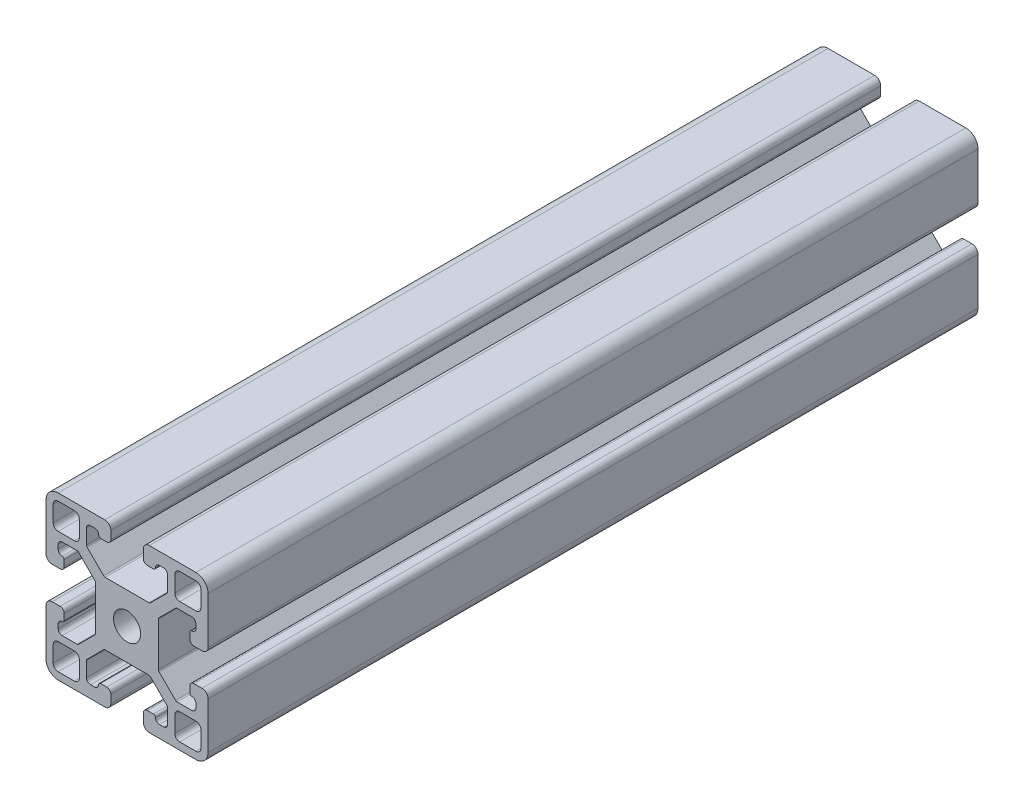
from build123d import *

# Parameters (mm, degrees)
SKETCH1_R           = 3.35
BOSS_EXTRUDE1_DEPTH = 190


with BuildPart() as part:
    # Sketch1 → Boss-Extrude1 (new body)
    with BuildSketch(Plane.XY):
        with BuildLine():
            Line((-9.853553391, -11.978553391), (-5.771446609, -7.896446609))
            ThreePointArc((-5.771446609, -7.896446609), (-5.609234935, -7.788060234), (-5.417893219, -7.75))
            Line((-5.417893219, -7.75), (5.417893219, -7.75))
            ThreePointArc((5.417893219, -7.75), (5.609234935, -7.788060234), (5.771446609, -7.896446609))
            Line((5.771446609, -7.896446609), (9.853553391, -11.978553391))
            ThreePointArc((9.853553391, -11.978553391), (9.961939766, -12.140765065), (10, -12.332106781))
            Line((10, -12.332106781), (10, -16))
            ThreePointArc((10, -16), (9.707106781, -16.707106781), (9, -17))
            Line((9, -17), (8, -17))
            ThreePointArc((8, -17), (7.292893219, -16.707106781), (7, -16))
            ThreePointArc((7, -16), (6.853553391, -15.646446609), (6.5, -15.5))
            Line((6.5, -15.5), (5, -15.5))
            ThreePointArc((5, -15.5), (4.292893219, -15.792893219), (4, -16.5))
            Line((4, -16.5), (4, -18.5))
            ThreePointArc((4, -18.5), (4.439339828, -19.560660172), (5.5, -20))
            Line((5.5, -20), (17, -20))
            ThreePointArc((17, -20), (19.121320344, -19.121320344), (20, -17))
            Line((20, -17), (20, -5.5))
            ThreePointArc((20, -5.5), (19.560660172, -4.439339828), (18.5, -4))
            Line((18.5, -4), (16.5, -4))
            ThreePointArc((16.5, -4), (15.792893219, -4.292893219), (15.5, -5))
            Line((15.5, -5), (15.5, -6.5))
            ThreePointArc((15.5, -6.5), (15.646446609, -6.853553391), (16, -7))
            ThreePointArc((16, -7), (16.707106781, -7.292893219), (17, -8))
            Line((17, -8), (17, -9))
            ThreePointArc((17, -9), (16.707106781, -9.707106781), (16, -10))
            Line((16, -10), (12.332106781, -10))
            ThreePointArc((12.332106781, -10), (12.140765065, -9.961939766), (11.978553391, -9.853553391))
            Line((11.978553391, -9.853553391), (7.896446609, -5.771446609))
            ThreePointArc((7.896446609, -5.771446609), (7.788060234, -5.609234935), (7.75, -5.417893219))
            Line((7.75, -5.417893219), (7.75, 5.417893219))
            ThreePointArc((7.75, 5.417893219), (7.788060234, 5.609234935), (7.896446609, 5.771446609))
            Line((7.896446609, 5.771446609), (11.978553391, 9.853553391))
            ThreePointArc((11.978553391, 9.853553391), (12.140765065, 9.961939766), (12.332106781, 10))
            Line((12.332106781, 10), (16, 10))
            ThreePointArc((16, 10), (16.707106781, 9.707106781), (17, 9))
            Line((17, 9), (17, 8))
            ThreePointArc((17, 8), (16.707106781, 7.292893219), (16, 7))
            ThreePointArc((16, 7), (15.646446609, 6.853553391), (15.5, 6.5))
            Line((15.5, 6.5), (15.5, 5))
            ThreePointArc((15.5, 5), (15.792893219, 4.292893219), (16.5, 4))
            Line((16.5, 4), (18.5, 4))
            ThreePointArc((18.5, 4), (19.560660172, 4.439339828), (20, 5.5))
            Line((20, 5.5), (20, 17))
            ThreePointArc((20, 17), (19.121320344, 19.121320344), (17, 20))
            Line((17, 20), (5.5, 20))
            ThreePointArc((5.5, 20), (4.439339828, 19.560660172), (4, 18.5))
            Line((4, 18.5), (4, 16.5))
            ThreePointArc((4, 16.5), (4.292893219, 15.792893219), (5, 15.5))
            Line((5, 15.5), (6.5, 15.5))
            ThreePointArc((6.5, 15.5), (6.853553391, 15.646446609), (7, 16))
            ThreePointArc((7, 16), (7.292893219, 16.707106781), (8, 17))
            Line((8, 17), (9, 17))
            ThreePointArc((9, 17), (9.707106781, 16.707106781), (10, 16))
            Line((10, 16), (10, 12.332106781))
            ThreePointArc((10, 12.332106781), (9.961939766, 12.140765065), (9.853553391, 11.978553391))
            Line((9.853553391, 11.978553391), (5.771446609, 7.896446609))
            ThreePointArc((5.771446609, 7.896446609), (5.609234935, 7.788060234), (5.417893219, 7.75))
            Line((5.417893219, 7.75), (-5.417893219, 7.75))
            ThreePointArc((-5.417893219, 7.75), (-5.609234935, 7.788060234), (-5.771446609, 7.896446609))
            Line((-5.771446609, 7.896446609), (-9.853553391, 11.978553391))
            ThreePointArc((-9.853553391, 11.978553391), (-9.961939766, 12.140765065), (-10, 12.332106781))
            Line((-10, 12.332106781), (-10, 16))
            ThreePointArc((-10, 16), (-9.707106781, 16.707106781), (-9, 17))
            Line((-9, 17), (-8, 17))
            ThreePointArc((-8, 17), (-7.292893219, 16.707106781), (-7, 16))
            ThreePointArc((-7, 16), (-6.853553391, 15.646446609), (-6.5, 15.5))
            Line((-6.5, 15.5), (-5, 15.5))
            ThreePointArc((-5, 15.5), (-4.292893219, 15.792893219), (-4, 16.5))
            Line((-4, 16.5), (-4, 18.5))
            ThreePointArc((-4, 18.5), (-4.439339828, 19.560660172), (-5.5, 20))
            Line((-5.5, 20), (-17, 20))
            ThreePointArc((-17, 20), (-19.121320344, 19.121320344), (-20, 17))
            Line((-20, 17), (-20, 5.5))
            ThreePointArc((-20, 5.5), (-19.560660172, 4.439339828), (-18.5, 4))
            Line((-18.5, 4), (-16.5, 4))
            ThreePointArc((-16.5, 4), (-15.792893219, 4.292893219), (-15.5, 5))
            Line((-15.5, 5), (-15.5, 6.5))
            ThreePointArc((-15.5, 6.5), (-15.646446609, 6.853553391), (-16, 7))
            ThreePointArc((-16, 7), (-16.707106781, 7.292893219), (-17, 8))
            Line((-17, 8), (-17, 9))
            ThreePointArc((-17, 9), (-16.707106781, 9.707106781), (-16, 10))
            Line((-16, 10), (-12.332106781, 10))
            ThreePointArc((-12.332106781, 10), (-12.140765065, 9.961939766), (-11.978553391, 9.853553391))
            Line((-11.978553391, 9.853553391), (-7.896446609, 5.771446609))
            ThreePointArc((-7.896446609, 5.771446609), (-7.788060234, 5.609234935), (-7.75, 5.417893219))
            Line((-7.75, 5.417893219), (-7.75, -5.417893219))
            ThreePointArc((-7.75, -5.417893219), (-7.788060234, -5.609234935), (-7.896446609, -5.771446609))
            Line((-7.896446609, -5.771446609), (-11.978553391, -9.853553391))
            ThreePointArc((-11.978553391, -9.853553391), (-12.140765065, -9.961939766), (-12.332106781, -10))
            Line((-12.332106781, -10), (-16, -10))
            ThreePointArc((-16, -10), (-16.707106781, -9.707106781), (-17, -9))
            Line((-17, -9), (-17, -8))
            ThreePointArc((-17, -8), (-16.707106781, -7.292893219), (-16, -7))
            ThreePointArc((-16, -7), (-15.646446609, -6.853553391), (-15.5, -6.5))
            Line((-15.5, -6.5), (-15.5, -5))
            ThreePointArc((-15.5, -5), (-15.792893219, -4.292893219), (-16.5, -4))
            Line((-16.5, -4), (-18.5, -4))
            ThreePointArc((-18.5, -4), (-19.560660172, -4.439339828), (-20, -5.5))
            Line((-20, -5.5), (-20, -17))
            ThreePointArc((-20, -17), (-19.121320344, -19.121320344), (-17, -20))
            Line((-17, -20), (-5.5, -20))
            ThreePointArc((-5.5, -20), (-4.439339828, -19.560660172), (-4, -18.5))
            Line((-4, -18.5), (-4, -16.5))
            ThreePointArc((-4, -16.5), (-4.292893219, -15.792893219), (-5, -15.5))
            Line((-5, -15.5), (-6.5, -15.5))
            ThreePointArc((-6.5, -15.5), (-6.853553391, -15.646446609), (-7, -16))
            ThreePointArc((-7, -16), (-7.292893219, -16.707106781), (-8, -17))
            Line((-8, -17), (-9, -17))
            ThreePointArc((-9, -17), (-9.707106781, -16.707106781), (-10, -16))
            Line((-10, -16), (-10, -12.332106781))
            ThreePointArc((-10, -12.332106781), (-9.961939766, -12.140765065), (-9.853553391, -11.978553391))
        make_face()
        Circle(SKETCH1_R, mode=Mode.SUBTRACT)
        with BuildLine():
            Line((-17, 11.78), (-13, 11.78))
            ThreePointArc((-13, 11.78), (-12.137329727, 12.137329727), (-11.78, 13))
            Line((-11.78, 13), (-11.78, 17))
            ThreePointArc((-11.78, 17), (-12.137329727, 17.862670273), (-13, 18.22))
            Line((-13, 18.22), (-17, 18.22))
            ThreePointArc((-17, 18.22), (-17.862670273, 17.862670273), (-18.22, 17))
            Line((-18.22, 17), (-18.22, 13))
            ThreePointArc((-18.22, 13), (-17.862670273, 12.137329727), (-17, 11.78))
        make_face(mode=Mode.SUBTRACT)
        with BuildLine():
            Line((-18.22, -13), (-18.22, -17))
            ThreePointArc((-18.22, -17), (-17.862670273, -17.862670273), (-17, -18.22))
            Line((-17, -18.22), (-13, -18.22))
            ThreePointArc((-13, -18.22), (-12.137329727, -17.862670273), (-11.78, -17))
            Line((-11.78, -17), (-11.78, -13))
            ThreePointArc((-11.78, -13), (-12.137329727, -12.137329727), (-13, -11.78))
            Line((-13, -11.78), (-17, -11.78))
            ThreePointArc((-17, -11.78), (-17.862670273, -12.137329727), (-18.22, -13))
        make_face(mode=Mode.SUBTRACT)
        with BuildLine():
            Line((13, -18.22), (17, -18.22))
            ThreePointArc((17, -18.22), (17.862670273, -17.862670273), (18.22, -17))
            Line((18.22, -17), (18.22, -13))
            ThreePointArc((18.22, -13), (17.862670273, -12.137329727), (17, -11.78))
            Line((17, -11.78), (13, -11.78))
            ThreePointArc((13, -11.78), (12.137329727, -12.137329727), (11.78, -13))
            Line((11.78, -13), (11.78, -17))
            ThreePointArc((11.78, -17), (12.137329727, -17.862670273), (13, -18.22))
        make_face(mode=Mode.SUBTRACT)
        with BuildLine():
            Line((18.22, 13), (18.22, 17))
            ThreePointArc((18.22, 17), (17.862670273, 17.862670273), (17, 18.22))
            Line((17, 18.22), (13, 18.22))
            ThreePointArc((13, 18.22), (12.137329727, 17.862670273), (11.78, 17))
            Line((11.78, 17), (11.78, 13))
            ThreePointArc((11.78, 13), (12.137329727, 12.137329727), (13, 11.78))
            Line((13, 11.78), (17, 11.78))
            ThreePointArc((17, 11.78), (17.862670273, 12.137329727), (18.22, 13))
        make_face(mode=Mode.SUBTRACT)
    extrude(amount=BOSS_EXTRUDE1_DEPTH)


solid = part.part
